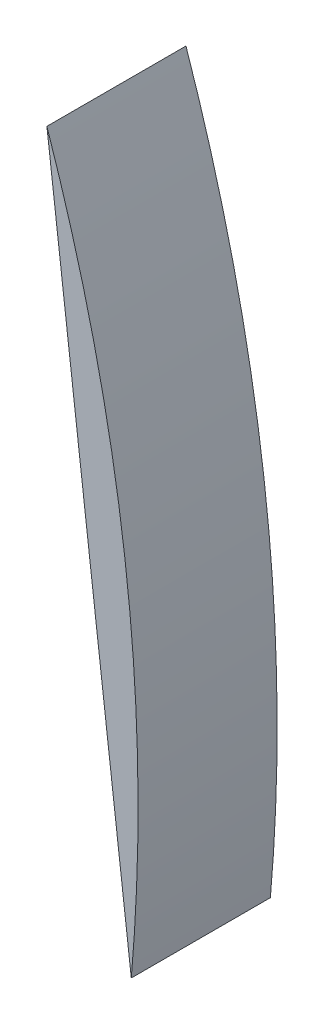
from build123d import *

# Parameters (mm, degrees)
BOSS_EXTRUDE1_DEPTH = 100


with BuildPart() as part:
    # Sketch1 → Boss-Extrude1 (new body)
    with BuildSketch(Plane.XY):
        with BuildLine():
            Line((0, 0), (-60.693641618, 500))
            add(Edge.make_bspline(
                [(0, 0), (22.709077536, 255.620760675), (-60.693641618, 500)],
                knots=[0, 0, 0, 1, 1, 1], degree=2))
        make_face()
    extrude(amount=BOSS_EXTRUDE1_DEPTH)


solid = part.part
